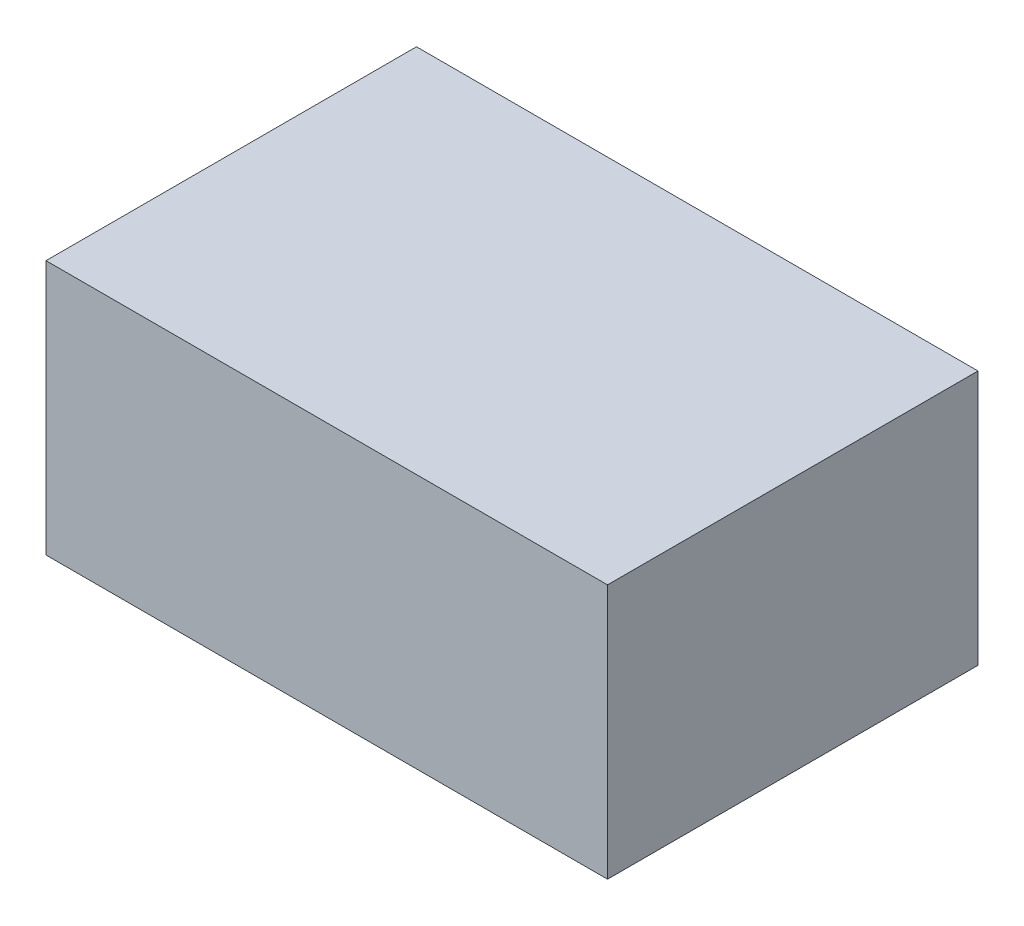
from build123d import *

# Parameters (mm, degrees)
SKETCH1_W           = 50
SKETCH1_H           = 32.988169243
BOSS_EXTRUDE1_DEPTH = 22.7


with BuildPart() as part:
    # Sketch1 → Boss-Extrude1 (new body)
    with BuildSketch(Plane.XZ.offset(-94.843926475)):
        with Locations((468.482459861, -169.676894361)):
            Rectangle(SKETCH1_W, SKETCH1_H)
    extrude(amount=BOSS_EXTRUDE1_DEPTH)


solid = part.part
